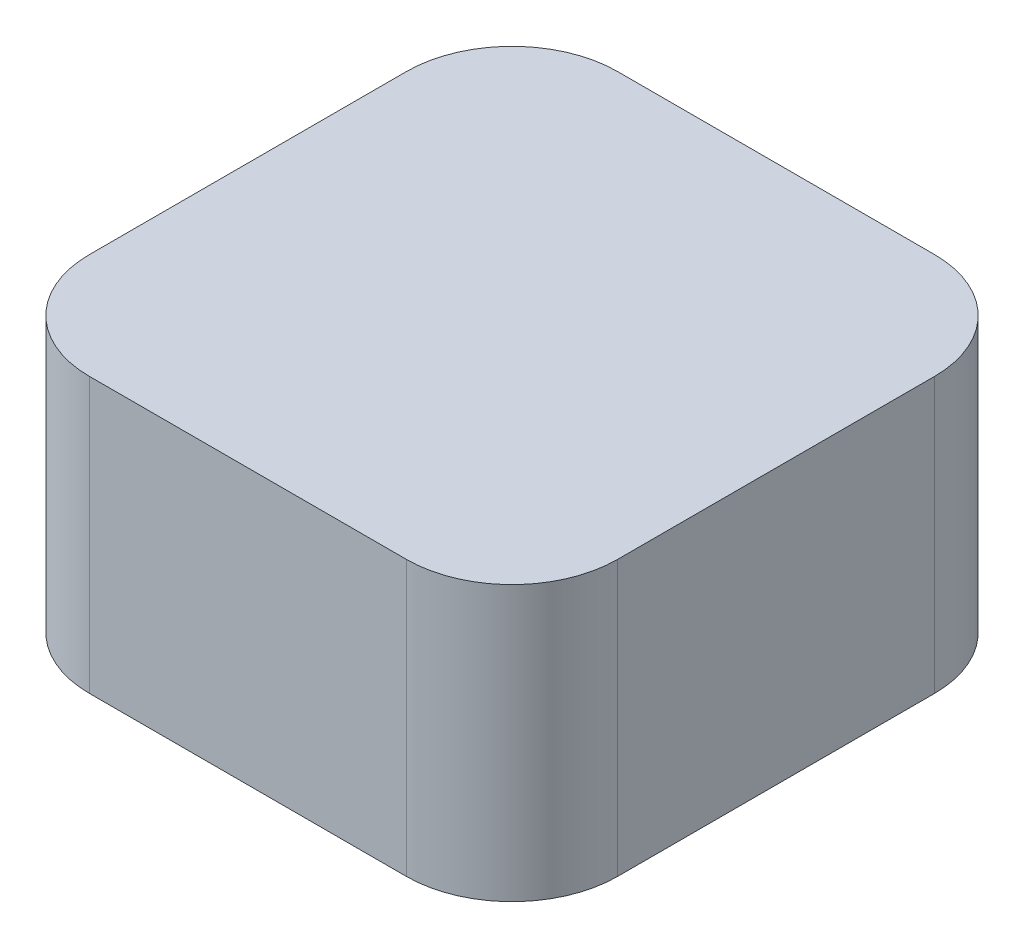
from build123d import *

# Parameters (mm, degrees)
SKETCH1_W           = 12.5
SKETCH1_H           = 12.5
BOSS_EXTRUDE1_DEPTH = 6.5
FILLET1_R           = 2.5


with BuildPart() as part:
    # Sketch1 → Boss-Extrude1 (new body)
    with BuildSketch(Plane(origin=(0, 0, 0), x_dir=(1, 0, 0), z_dir=(0, 1, 0))):
        with Locations((6.25, 6.25)):
            Rectangle(SKETCH1_W, SKETCH1_H)
    extrude(amount=BOSS_EXTRUDE1_DEPTH)

    # Fillet1
    fillet1_edges = [part.edges().sort_by_distance(p)[0] for p in [
        (0, 3.25, -12.5),
        (12.5, 3.25, -12.5),
        (12.5, 3.25, 0),
        (0, 3.25, 0),
    ]]
    fillet(fillet1_edges, radius=FILLET1_R)


solid = part.part
